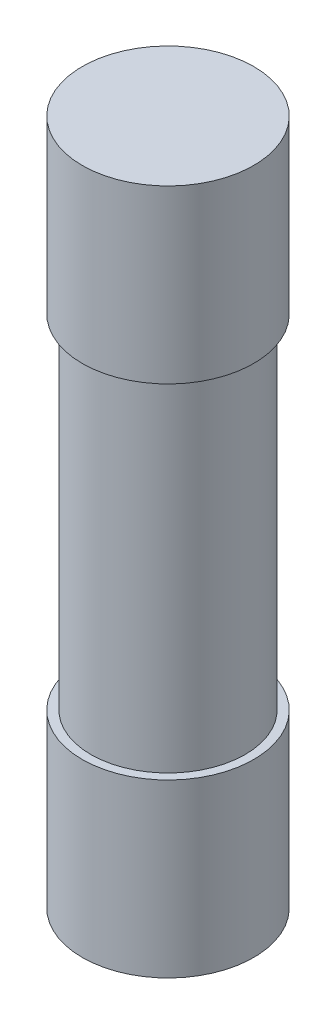
from build123d import *

# Parameters (mm, degrees)
SKETCH1_R           = 2.5
BOSS_EXTRUDE1_DEPTH = 5
SKETCH2_R           = 2.25
BOSS_EXTRUDE2_DEPTH = 10
SKETCH3_R           = 2.5
BOSS_EXTRUDE3_DEPTH = 5


with BuildPart() as part:
    # Sketch1 → Boss-Extrude1 (new body)
    with BuildSketch(Plane(origin=(0, 0, 0), x_dir=(1, 0, 0), z_dir=(0, 1, 0))):
        with Locations(Location((0, 0, 0), (0, 0, 270))):
            Circle(SKETCH1_R)
    extrude(amount=BOSS_EXTRUDE1_DEPTH)


with BuildPart() as body_2:
    # Sketch2 → Boss-Extrude2 (new body)
    with BuildSketch(Plane(origin=(0, 5, 0), x_dir=(1, 0, 0), z_dir=(0, 1, 0))):
        with Locations(Location((0, 0, 0), (0, 0, 270))):
            Circle(SKETCH2_R)
    extrude(amount=BOSS_EXTRUDE2_DEPTH)


with BuildPart() as body_3:
    # Sketch3 → Boss-Extrude3 (new body)
    with BuildSketch(Plane(origin=(0, 15, 0), x_dir=(1, 0, 0), z_dir=(0, 1, 0))):
        with Locations(Location((0, 0, 0), (0, 0, 270))):
            Circle(SKETCH3_R)
    extrude(amount=BOSS_EXTRUDE3_DEPTH)


solid = Compound([part.part, body_2.part, body_3.part])
